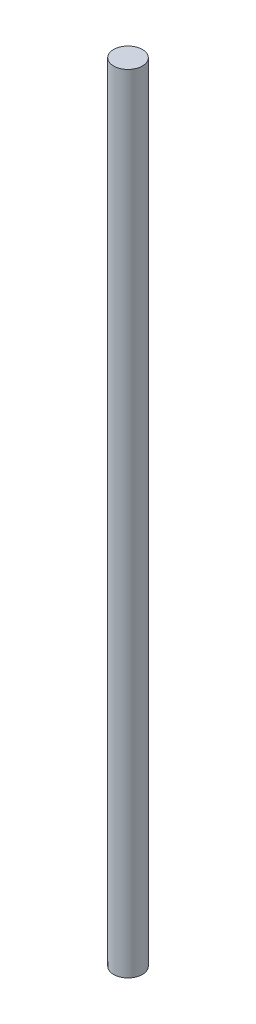
from build123d import *

# Parameters (mm, degrees)
SKETCH1_R           = 6.35
BOSS_EXTRUDE1_DEPTH = 348.00032


with BuildPart() as part:
    # Sketch1 → Boss-Extrude1 (new body)
    with BuildSketch(Plane(origin=(0, 0, 0), x_dir=(1, 0, 0), z_dir=(0, 1, 0))):
        with Locations(Location((0, 0, 0), (0, 0, 90))):
            Circle(SKETCH1_R)
    extrude(amount=BOSS_EXTRUDE1_DEPTH)


solid = part.part
